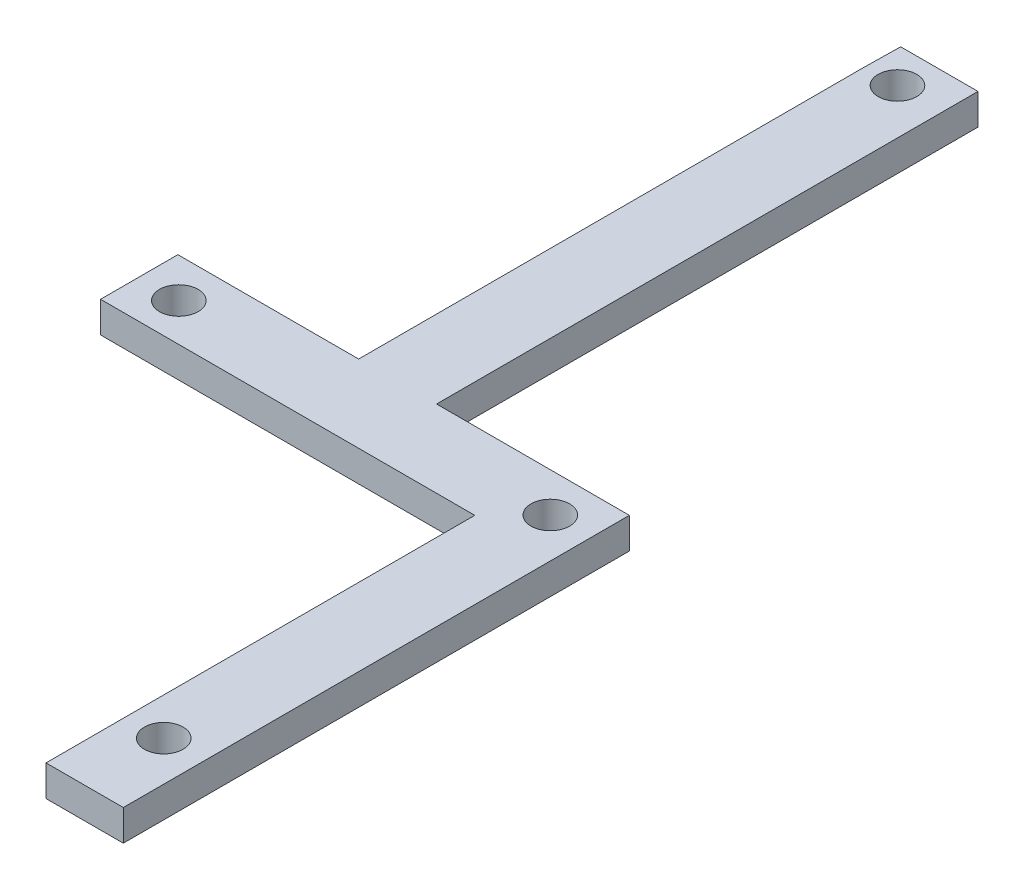
from build123d import *

# Parameters (mm, degrees)
SALIENTE_EXTRUIR2_DEPTH = 2
CROQUIS2_R              = 1.25
CORTAR_EXTRUIR1_DEPTH   = 2


with BuildPart() as part:
    # Croquis1 → Saliente-Extruir2 (new body)
    with BuildSketch(Plane(origin=(0, 0, 0), x_dir=(1, 0, 0), z_dir=(0, 1, 0))):
        Polygon((15.056023907, 39.704773072), (15.056023907, 26.168187684), (15.056023907, 7.074316274), (3.362466557, 7.074316274), (3.362466557, 2.074316274), (27.565385425, 2.074316274), (27.565385425, -25.657265495), (32.565385425, -25.657265495), (32.565385425, 7.074316274), (20.094799992, 7.074316274), (20.094799992, 42.092248366), (15.094799992, 42.092248366), align=None)
    extrude(amount=SALIENTE_EXTRUIR2_DEPTH)

    # Croquis2 → Cortar-Extruir1 (cut)
    with BuildSketch(Plane(origin=(0, 2, 0), x_dir=(1, 0, 0), z_dir=(0, 1, 0))):
        with Locations(Location((17.158653271, 39.819787948, 0), (0, 0, 270))):
            Circle(CROQUIS2_R)
        with Locations(Location((5.962263761, 4.535787948, 0), (0, 0, 270))):
            Circle(CROQUIS2_R)
        with Locations(Location((29.988653271, 4.535787948, 0), (0, 0, 270))):
            Circle(CROQUIS2_R)
        with Locations(Location((29.988653271, -20.46630955, 0), (0, 0, 270))):
            Circle(CROQUIS2_R)
    extrude(amount=-CORTAR_EXTRUIR1_DEPTH, mode=Mode.SUBTRACT)


solid = part.part
